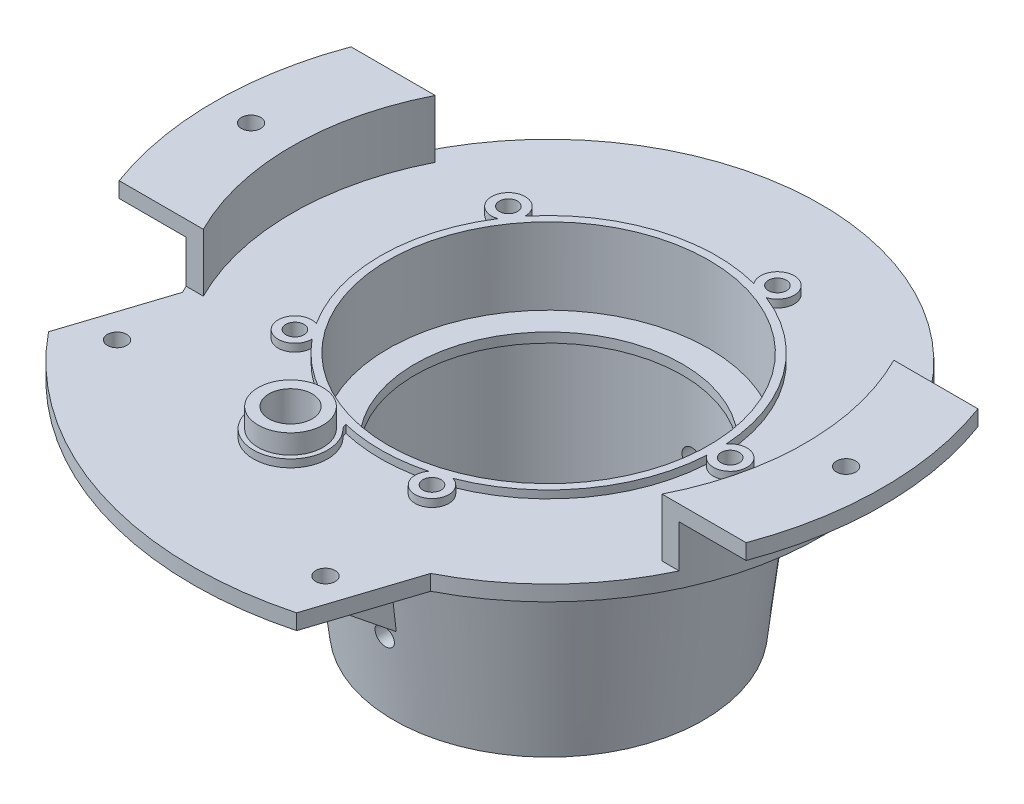
from build123d import *

# Parameters (mm, degrees)
SKETCH2_R               = 2.5
CUT_EXTRUDE3_DEPTH      = 4
CUT_EXTRUDE4_REACH      = 145.647
CUT_EXTRUDE6_DEPTH      = 127.840805737
CUT_EXTRUDE6_DEPTH_BACK = 127.840805737
SKETCH6_R               = 2.5
CUT_EXTRUDE7_REACH      = 128.841
SKETCH7_R               = 2.35
CIRPATTERN1_COUNT       = 5
SKETCH9_R               = 5.6
CUT_EXTRUDE8_DEPTH      = 127.840805784
BOSS_EXTRUDE1_START     = 2
SKETCH8_R               = 41.5
SKETCH8_R_2             = 2.35
SKETCH8_R_3             = 5.6
BOSS_EXTRUDE1_DEPTH     = 2
BOSS_EXTRUDE2_START     = 5
SKETCH10_R              = 8.4
SKETCH10_R_2            = 5.6
BOSS_EXTRUDE2_DEPTH     = 5
BOSS_EXTRUDE3_DEPTH     = 4
CUT_EXTRUDE9_REACH      = 141.937
SKETCH16_R              = 2.5
BOSS_EXTRUDE8_DEPTH     = 2.5


with BuildPart() as part:
    # Sketch1 → Revolve1 (revolve)
    with BuildSketch(Plane.XY, mode=Mode.PRIVATE) as revolve1_sk:
        Polygon((-70.5, -4), (-70.5, 11), (-86.5, 11), (-86.5, 15), (-66.5, 15), (-66.5, 0), (-41.5, 0), (-41.5, -17.8), (-37.5, -17.8), (-34.6, -17.8), (-34.6, -20.3), (-37.1, -20.3), (-37.1, -60.3), (-40.1, -60.3), (-45.5, -15), (-56.5, -4), align=None)
    revolve(revolve1_sk.sketch.rotate(Axis((0, -100.5, 0), (0, 1, 0)), 270), axis=Axis((0, -100.5, 0), (0, 1, 0)))

    # Sketch2 → Cut-Extrude3 (cut)
    with BuildSketch(Plane.XZ.offset(-11)):
        with Locations(Location((77, 0, 0), (0, 0, 270))):
            Circle(SKETCH2_R)
        with Locations(Location((-77, 0, 0), (0, 0, 270))):
            Circle(SKETCH2_R)
    extrude(amount=-CUT_EXTRUDE3_DEPTH, mode=Mode.SUBTRACT)

    # Cut-Extrude4: up to this face of the body (flat: up to its plane)
    cut_extrude4_end = Plane(part.part.faces().sort_by_distance((0, 0, 64.619095962))[0])
    # Sketch3 → Cut-Extrude4 (cut, up to the picked face)
    with BuildSketch(Plane(origin=(0, 15, 0), x_dir=(1, 0, 0), z_dir=(0, 1, 0)), mode=Mode.PRIVATE) as cut_extrude4_sk1:
        with BuildLine():
            Line((-59.348546739, -30), (-81.131066799, -30))
            ThreePointArc((-81.131066799, -30), (0, -86.5), (81.131066799, -30))
            Line((81.131066799, -30), (59.348546739, -30))
            ThreePointArc((59.348546739, -30), (0, -66.5), (-59.348546739, -30))
        make_face()
    cut_extrude4_tool1 = split(extrude(cut_extrude4_sk1.sketch, amount=-CUT_EXTRUDE4_REACH, mode=Mode.PRIVATE), bisect_by=cut_extrude4_end, keep=Keep.BOTH, mode=Mode.PRIVATE)
    # Sketch3 → Cut-Extrude4 (cut, up to the picked face)
    with BuildSketch(Plane(origin=(0, 15, 0), x_dir=(1, 0, 0), z_dir=(0, 1, 0)), mode=Mode.PRIVATE) as cut_extrude4_sk2:
        with BuildLine():
            Line((81.131066799, 30), (59.348546739, 30))
            ThreePointArc((59.348546739, 30), (0, 66.5), (-59.348546739, 30))
            Line((-59.348546739, 30), (-81.131066799, 30))
            ThreePointArc((-81.131066799, 30), (0, 86.5), (81.131066799, 30))
        make_face()
    cut_extrude4_tool2 = split(extrude(cut_extrude4_sk2.sketch, amount=-CUT_EXTRUDE4_REACH, mode=Mode.PRIVATE), bisect_by=cut_extrude4_end, keep=Keep.BOTH, mode=Mode.PRIVATE)
    add(cut_extrude4_tool1.solids().sort_by(Axis((70.239807, 15, 31.718175), (0, -1, 0)))[0], mode=Mode.SUBTRACT)
    add(cut_extrude4_tool2.solids().sort_by(Axis((0, 15, -84.781825), (0, -1, 0)))[0], mode=Mode.SUBTRACT)

    # Sketch6 → Cut-Extrude6 (cut, two sides: drawn at the far end of the back side and taken through both)
    with BuildSketch(Plane.XY.offset(-CUT_EXTRUDE6_DEPTH_BACK)):
        with Locations((0, -40.3)):
            Circle(SKETCH6_R)
    extrude(amount=CUT_EXTRUDE6_DEPTH + CUT_EXTRUDE6_DEPTH_BACK, mode=Mode.SUBTRACT)

    # Cut-Extrude7: up to this cone (the profile starts inside it)
    cut_extrude7_end = Plane(origin=(0, 0, 0), z_dir=(0, 1, 0)).offset(-60.499999) * Cone(1e-06, 250.341, 250.340999, align=(Align.CENTER, Align.CENTER, Align.MIN), mode=Mode.PRIVATE)
    # Sketch7 → Cut-Extrude7 (cut, up to the surface)
    with BuildSketch(Plane(origin=(0, 0, 0), x_dir=(1, 0, 0), z_dir=(0, 1, 0)), mode=Mode.PRIVATE) as cut_extrude7_sk1:
        with Locations(Location((47, 0, 0), (0, 0, 270))):
            Circle(SKETCH7_R)
    cut_extrude7_tool1 = extrude(cut_extrude7_sk1.sketch, amount=-CUT_EXTRUDE7_REACH, mode=Mode.PRIVATE) & cut_extrude7_end
    cut_extrude7 = cut_extrude7_tool1.solids().sort_by_distance((47, 0, 0))[0]
    add(cut_extrude7, mode=Mode.SUBTRACT)

    # CirPattern1: Cut-Extrude7 ×5 about axis
    cirpattern1_axis = Axis((0, 0, 0), (0, 1, 0))
    for i in range(1, CIRPATTERN1_COUNT):
        add(cut_extrude7.rotate(cirpattern1_axis, i * 360 / CIRPATTERN1_COUNT), mode=Mode.SUBTRACT)

    # Sketch9 → Cut-Extrude8 (cut, through all)
    with BuildSketch(Plane(origin=(0, 0, 0), x_dir=(1, 0, 0), z_dir=(0, 1, 0))):
        with Locations(Location((-16.376983406, -50.406293402, 0), (0, 0, 270))):
            Circle(SKETCH9_R)
    extrude(amount=-CUT_EXTRUDE8_DEPTH, mode=Mode.SUBTRACT)

    # Sketch8 → Boss-Extrude1 (add)
    with BuildSketch(Plane(origin=(0, 0, 0), x_dir=(1, 0, 0), z_dir=(0, 1, 0)).offset(BOSS_EXTRUDE1_START)):
        with BuildLine():
            ThreePointArc((-33.674715891, -27.536584932), (-26.232120028, -34.700516982), (-17.310153819, -39.907500232))
            ThreePointArc((-17.310153819, -39.907500232), (-18.151240911, -40.857529263), (-19.348484237, -41.277756673))
            ThreePointArc((-19.348484237, -41.277756673), (-18.751226404, -59.708065824), (-9.393975098, -43.818608302))
            ThreePointArc((-9.393975098, -43.818608302), (-9.934550997, -43.138638053), (-10.154306094, -42.298227714))
            ThreePointArc((-10.154306094, -42.298227714), (0.465815846, -43.497505855), (11.057818915, -42.071066552))
            ThreePointArc((11.057818915, -42.071066552), (15.868022661, -48.836752112), (15.782789045, -40.535830693))
            ThreePointArc((15.782789045, -40.535830693), (35.192239255, -25.568658475), (43.429015957, -2.484063801))
            ThreePointArc((43.429015957, -2.484063801), (51.35, 0), (43.429015957, 2.484063801))
            ThreePointArc((43.429015957, 2.484063801), (35.192239255, 25.568658475), (15.782789045, 40.535830693))
            ThreePointArc((15.782789045, 40.535830693), (15.868022661, 48.836752112), (11.057818915, 42.071066552))
            ThreePointArc((11.057818915, 42.071066552), (-13.442239255, 41.370958459), (-33.674715891, 27.536584932))
            ThreePointArc((-33.674715891, 27.536584932), (-41.543022661, 30.182772705), (-36.594908027, 23.517285271))
            ThreePointArc((-36.594908027, 23.517285271), (-43.5, 0), (-36.594908027, -23.517285271))
            ThreePointArc((-36.594908027, -23.517285271), (-41.543022661, -30.182772705), (-33.674715891, -27.536584932))
        make_face()
        with Locations(Location((0, 0, 0), (0, 0, 90))):
            Circle(SKETCH8_R, mode=Mode.SUBTRACT)
        with Locations(Location((-38.023798736, -27.625906858, 0), (0, 0, 270))):
            Circle(SKETCH8_R_2, mode=Mode.SUBTRACT)
        with Locations(Location((14.523798736, -44.699656266, 0), (0, 0, 270))):
            Circle(SKETCH8_R_2, mode=Mode.SUBTRACT)
        with Locations(Location((47, 0, 0), (0, 0, 270))):
            Circle(SKETCH8_R_2, mode=Mode.SUBTRACT)
        with Locations(Location((14.523798736, 44.699656266, 0), (0, 0, 270))):
            Circle(SKETCH8_R_2, mode=Mode.SUBTRACT)
        with Locations(Location((-38.023798736, 27.625906858, 0), (0, 0, 270))):
            Circle(SKETCH8_R_2, mode=Mode.SUBTRACT)
        with Locations(Location((-16.376983406, -50.406293402, 0), (0, 0, 270))):
            Circle(SKETCH8_R_3, mode=Mode.SUBTRACT)
    extrude(amount=-BOSS_EXTRUDE1_DEPTH)

    # Sketch10 → Boss-Extrude2 (add)
    with BuildSketch(Plane(origin=(0, 2, 0), x_dir=(1, 0, 0), z_dir=(0, 1, 0)).offset(BOSS_EXTRUDE2_START)):
        with Locations(Location((-16.376983406, -50.406293402, 0), (0, 0, 270))):
            Circle(SKETCH10_R)
        with Locations(Location((-16.376983406, -50.406293402, 0), (0, 0, 270))):
            Circle(SKETCH10_R_2, mode=Mode.SUBTRACT)
    extrude(amount=-BOSS_EXTRUDE2_DEPTH)

    # Sketch11 → Boss-Extrude3 (add)
    with BuildSketch(Plane(origin=(0, 0, 0), x_dir=(1, 0, 0), z_dir=(0, 1, 0))):
        with BuildLine():
            Line((-62.910888798, -31.819334855), (-71.41620674, -57.997632838))
            ThreePointArc((-71.41620674, -57.997632838), (-28.427971196, -87.497716848), (23.690007225, -88.897601529))
            Line((23.690007225, -88.897601529), (32.195325168, -62.719303546))
            ThreePointArc((32.195325168, -62.719303546), (-21.784477927, -67.049880846), (-62.910888798, -31.819334855))
        make_face()
    extrude(amount=-BOSS_EXTRUDE3_DEPTH)

    # Sketch16 → Cut-Extrude9 (cut, up to next)
    with BuildSketch(Plane(origin=(0, 0, 0), x_dir=(1, 0, 0), z_dir=(0, 1, 0)), mode=Mode.PRIVATE) as cut_extrude9_sk1:
        with Locations(Location((19.171506977, -76.914982637, 0), (0, 0, 270))):
            Circle(SKETCH16_R)
    cut_extrude9_tool1 = extrude(cut_extrude9_sk1.sketch, amount=-CUT_EXTRUDE9_REACH, mode=Mode.PRIVATE) & part.part
    # Sketch16 → Cut-Extrude9 (cut, up to next)
    with BuildSketch(Plane(origin=(0, 0, 0), x_dir=(1, 0, 0), z_dir=(0, 1, 0)), mode=Mode.PRIVATE) as cut_extrude9_sk2:
        with Locations(Location((-60.717712754, -50.959008937, 0), (0, 0, 270))):
            Circle(SKETCH16_R)
    cut_extrude9_tool2 = extrude(cut_extrude9_sk2.sketch, amount=-CUT_EXTRUDE9_REACH, mode=Mode.PRIVATE) & part.part
    add(cut_extrude9_tool1.solids().sort_by_distance((19.171507, 0, 76.914983))[0], mode=Mode.SUBTRACT)
    add(cut_extrude9_tool2.solids().sort_by_distance((-60.717713, 0, 50.959009))[0], mode=Mode.SUBTRACT)

    # Sketch18 → Boss-Extrude8 (add, symmetric)
    with BuildSketch(Plane(origin=(0, 0, 0), x_dir=(-0.6022386541602023, 0, 0.7983161049579974), z_dir=(-0.7983161049579974, 0, -0.6022386541602023))):
        Polygon((44.819385271, -15), (42.000310556, -38.13061492), (84.284739323, -4), (55.443716842, -4), align=None)
    boss_extrude8 = extrude(amount=BOSS_EXTRUDE8_DEPTH, both=True)

    # Mirror1: Boss-Extrude8 across plane
    add(boss_extrude8.mirror(Plane(origin=(0, 0, 0), x_dir=(-0.3089996869109695, 0, 0.9510621396569852), z_dir=(0.9510621396569853, 0, 0.3089996869109695))))


solid = part.part
